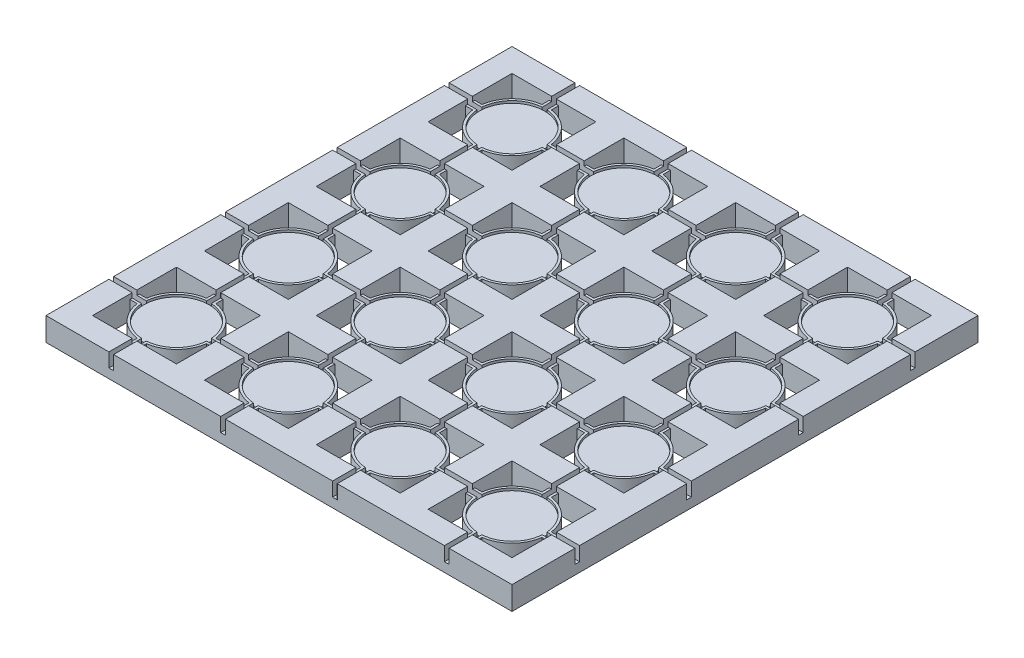
from build123d import *

# Parameters (mm, degrees)
SKETCH1_W            = 200
SKETCH1_H            = 200
BOSS_EXTRUDE1_DEPTH  = 10
CUT_EXTRUDE2_DEPTH   = 142.774468788
SKETCH3_W            = 36
SKETCH3_H            = 36
CUT_EXTRUDE3_DEPTH   = 2
SKETCH4_R            = 14
CUT_EXTRUDE4_DEPTH   = 1
SKETCH5_W            = 2
SKETCH5_H            = 10
SKETCH5_W_2          = 10
SKETCH5_H_2          = 2
CUT_EXTRUDE5_DEPTH   = 6
LPATTERN2_COUNT      = 4
LPATTERN2_PITCH      = 48
LPATTERN2_COUNT_DIR2 = 4
LPATTERN2_PITCH_DIR2 = 48
SKETCH6_W            = 36
SKETCH6_H            = 36
CUT_EXTRUDE6_DEPTH   = 2
LPATTERN3_COUNT      = 4
LPATTERN3_PITCH      = 48
LPATTERN3_COUNT_DIR2 = 4
LPATTERN3_PITCH_DIR2 = 48


with BuildPart() as part:
    # Sketch1 → Boss-Extrude1 (new body)
    with BuildSketch(Plane(origin=(0, 0, 0), x_dir=(1, 0, 0), z_dir=(0, 1, 0))):
        Rectangle(SKETCH1_W, SKETCH1_H)
    extrude(amount=BOSS_EXTRUDE1_DEPTH)

    # Sketch2 → Cut-Extrude2 (cut, through all)
    with BuildSketch(Plane(origin=(0, 10, 0), x_dir=(1, 0, 0), z_dir=(0, 1, 0))):
        with BuildLine():
            Line((-57.133931253, 74), (-54, 74))
            Line((-54, 74), (-54, 90))
            Line((-54, 90), (-70, 90))
            Line((-70, 90), (-70, 86.866068747))
            ThreePointArc((-70, 86.866068747), (-61.393398282, 82.606601718), (-57.133931253, 74))
        make_face()
        with BuildLine():
            Line((-70, 57.133931253), (-70, 54))
            Line((-70, 54), (-54, 54))
            Line((-54, 54), (-54, 70))
            Line((-54, 70), (-57.133931253, 70))
            ThreePointArc((-57.133931253, 70), (-61.393398282, 61.393398282), (-70, 57.133931253))
        make_face()
        with BuildLine():
            Line((-90, 70), (-90, 54))
            Line((-90, 54), (-74, 54))
            Line((-74, 54), (-74, 57.133931253))
            ThreePointArc((-74, 57.133931253), (-82.606601718, 61.393398282), (-86.866068747, 70))
            Line((-86.866068747, 70), (-90, 70))
        make_face()
        with BuildLine():
            Line((-90, 90), (-90, 74))
            Line((-90, 74), (-86.866068747, 74))
            ThreePointArc((-86.866068747, 74), (-82.606601718, 82.606601718), (-74, 86.866068747))
            Line((-74, 86.866068747), (-74, 90))
            Line((-74, 90), (-90, 90))
        make_face()
    cut_extrude2 = extrude(amount=-CUT_EXTRUDE2_DEPTH, mode=Mode.SUBTRACT)

    # Sketch3 → Cut-Extrude3 (cut)
    with BuildSketch(Plane(origin=(0, 10, 0), x_dir=(1, 0, 0), z_dir=(0, 1, 0))):
        with Locations((-72, 72)):
            Rectangle(SKETCH3_W, SKETCH3_H)
    cut_extrude3 = extrude(amount=-CUT_EXTRUDE3_DEPTH, mode=Mode.SUBTRACT)

    # Sketch4 → Cut-Extrude4 (cut)
    with BuildSketch(Plane(origin=(0, 8, 0), x_dir=(1, 0, 0), z_dir=(0, 1, 0))):
        with Locations(Location((-72, 72, 0), (0, 0, 270))):
            Circle(SKETCH4_R)
    cut_extrude4 = extrude(amount=-CUT_EXTRUDE4_DEPTH, mode=Mode.SUBTRACT)

    # Sketch5 → Cut-Extrude5 (cut)
    with BuildSketch(Plane(origin=(0, 10, 0), x_dir=(1, 0, 0), z_dir=(0, 1, 0))):
        with Locations((-72, 49)):
            Rectangle(SKETCH5_W, SKETCH5_H)
        with BuildLine():
            Line((-73, 58.035759956), (-73, 54))
            Line((-73, 54), (-71, 54))
            Line((-71, 54), (-71, 58.035759956))
            ThreePointArc((-71, 58.035759956), (-72, 58), (-73, 58.035759956))
        make_face()
        with Locations((-49, 72)):
            Rectangle(SKETCH5_W_2, SKETCH5_H_2)
        with BuildLine():
            Line((-54, 71), (-54, 73))
            Line((-54, 73), (-58.035759956, 73))
            ThreePointArc((-58.035759956, 73), (-58, 72), (-58.035759956, 71))
            Line((-58.035759956, 71), (-54, 71))
        make_face()
        with BuildLine():
            Line((-71, 90), (-73, 90))
            Line((-73, 90), (-73, 85.964240044))
            ThreePointArc((-73, 85.964240044), (-72, 86), (-71, 85.964240044))
            Line((-71, 85.964240044), (-71, 90))
        make_face()
        with Locations((-72, 95)):
            Rectangle(SKETCH5_W, SKETCH5_H)
        with Locations((-95, 72)):
            Rectangle(SKETCH5_W_2, SKETCH5_H_2)
        with BuildLine():
            Line((-85.964240044, 73), (-90, 73))
            Line((-90, 73), (-90, 71))
            Line((-90, 71), (-85.964240044, 71))
            ThreePointArc((-85.964240044, 71), (-86, 72), (-85.964240044, 73))
        make_face()
    cut_extrude5 = extrude(amount=-CUT_EXTRUDE5_DEPTH, mode=Mode.SUBTRACT)

    # LPattern2: Cut-Extrude2, Cut-Extrude3, Cut-Extrude4, Cut-Extrude5 4 × 4
    with Locations(*[(i * LPATTERN2_PITCH, 0, j * LPATTERN2_PITCH_DIR2) for i in range(LPATTERN2_COUNT) for j in range(LPATTERN2_COUNT_DIR2) if (i, j) != (0, 0)]):
        add(cut_extrude2, mode=Mode.SUBTRACT)
        add(cut_extrude3, mode=Mode.SUBTRACT)
        add(cut_extrude4, mode=Mode.SUBTRACT)
        add(cut_extrude5, mode=Mode.SUBTRACT)

    # Sketch6 → Cut-Extrude6 (cut)
    with BuildSketch(Plane.XZ):
        with Locations((-72, 72)):
            Rectangle(SKETCH6_W, SKETCH6_H)
    cut_extrude6 = extrude(amount=-CUT_EXTRUDE6_DEPTH, mode=Mode.SUBTRACT)

    # LPattern3: Cut-Extrude6 4 × 4
    with Locations(*[(j * LPATTERN3_PITCH_DIR2, 0, -i * LPATTERN3_PITCH) for i in range(LPATTERN3_COUNT) for j in range(LPATTERN3_COUNT_DIR2) if (i, j) != (0, 0)]):
        add(cut_extrude6, mode=Mode.SUBTRACT)


solid = part.part
